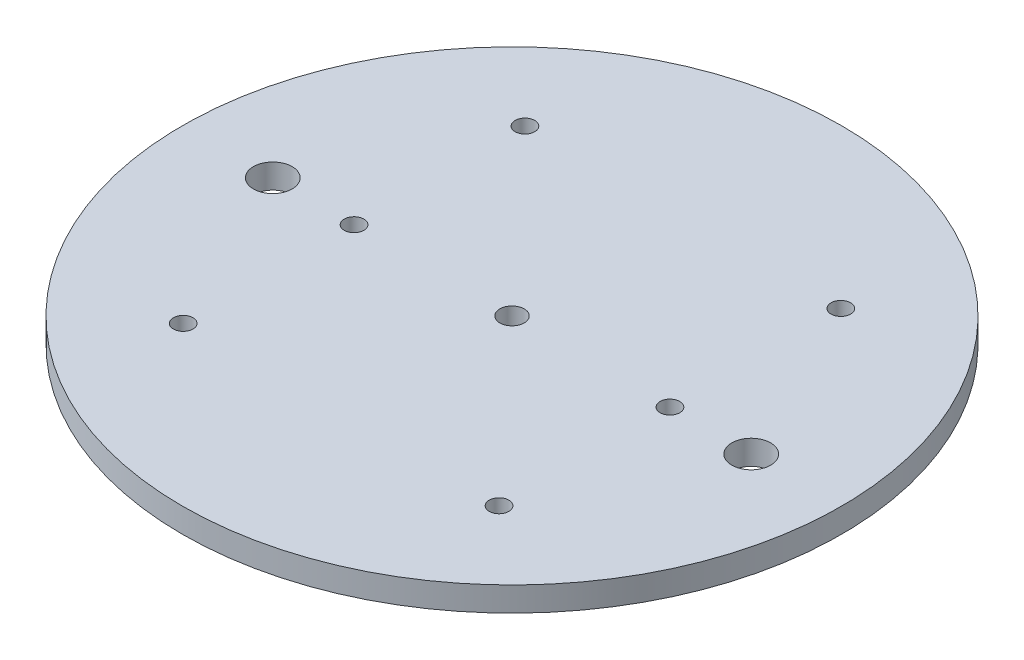
from build123d import *

# Parameters (mm, degrees)
SKETCH1_R                          = 85.725
BOSS_EXTRUDE1_DEPTH                = 6.35
F_3_8_CLEARANCE_HOLE1_D            = 10.0838
F_1_4_0_25_CLEARANCE_DOWEL_HOLE1_D = 6.35
F_10_CLEARANCE_HOLE1_D             = 5.1054
F_10_CLEARANCE_HOLE1_DEPTH         = 6.35


with BuildPart() as part:
    # Sketch1 → Boss-Extrude1 (new body)
    with BuildSketch(Plane(origin=(0, 0, 0), x_dir=(1, 0, 0), z_dir=(0, 1, 0))):
        with Locations(Location((0, 0, 0), (0, 0, 270))):
            Circle(SKETCH1_R)
    extrude(amount=BOSS_EXTRUDE1_DEPTH)

    # 3/8 Clearance Hole1 (through all)
    with Locations(Plane(origin=(0, 6.35, 0), x_dir=(0.9997060077974086, 0, 0.024246607469250614), z_dir=(0, 1, 0))):
        with Locations((-62.211704865, -1.508866383), (62.211704865, 1.508866383)):
            Hole(F_3_8_CLEARANCE_HOLE1_D / 2)

    # 1/4 (0.25) Clearance Dowel Hole1 (through all)
    with Locations(Plane(origin=(43.377433792, 6.35, -259.284531313), x_dir=(0.9888467421616725, 0, -0.14893663255306588), z_dir=(0, 1, 0))):
        with Locations((-81.510599056, -249.932175164)):
            Hole(F_1_4_0_25_CLEARANCE_DOWEL_HOLE1_D / 2)

    # #10 Clearance Hole1
    with Locations(Plane(origin=(43.377433792, 0, -259.284531313), x_dir=(-0.9888467421616725, 0, 0.14893663255306588), z_dir=(0, -1, 0))):
        with Locations((143.046531821, -240.66384852), (19.974666291, -259.200501808), (40.884325078, -256.051162244), (34.264091761, -212.096924555), (115.516639717, -199.858950395), (128.757106351, -287.767425773), (122.136873034, -243.813188084), (47.504558395, -300.005399933)):
            Hole(F_10_CLEARANCE_HOLE1_D / 2, depth=F_10_CLEARANCE_HOLE1_DEPTH)


solid = part.part
